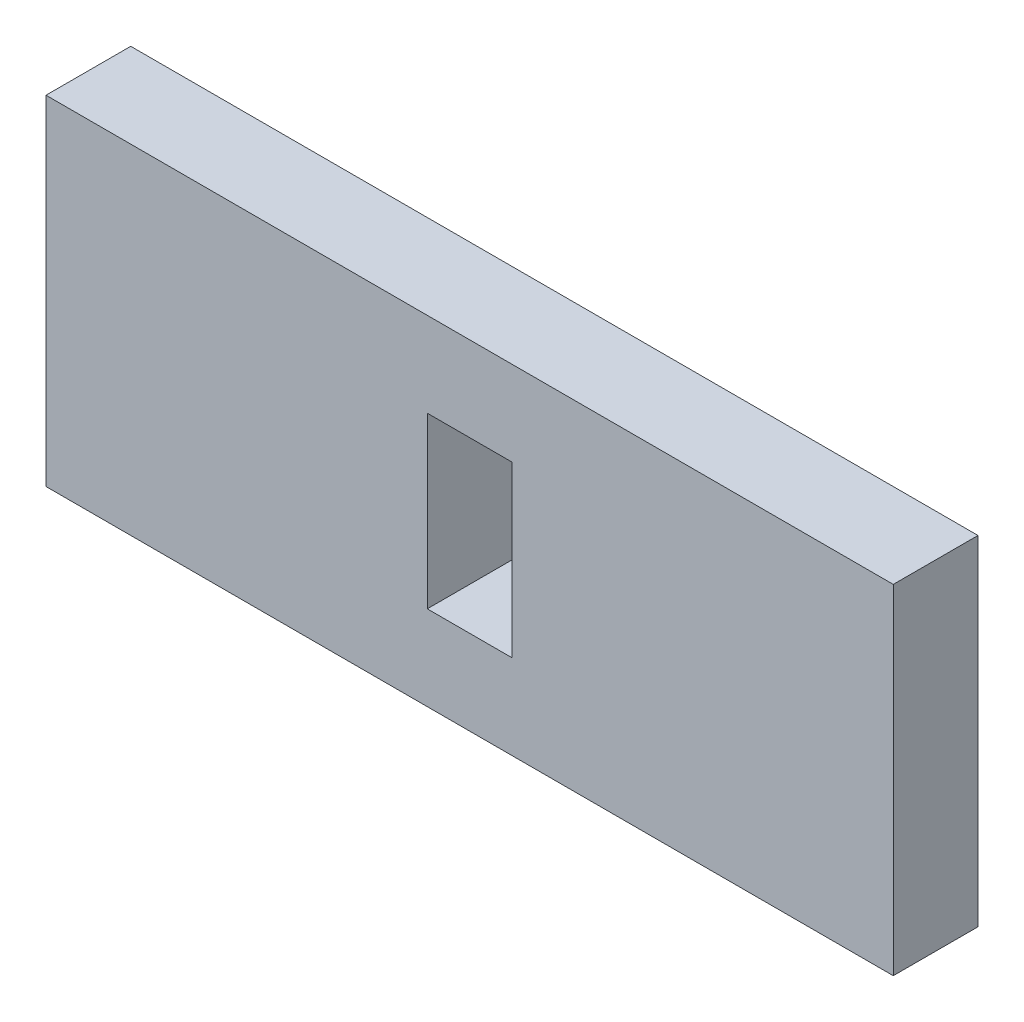
from build123d import *

# Parameters (mm, degrees)
ESQUISSE1_W        = 50
ESQUISSE1_H        = 20
ESQUISSE1_W_2      = 5
ESQUISSE1_H_2      = 10
BOSS_EXTRU_1_DEPTH = 5


with BuildPart() as part:
    # Esquisse1 → Boss.-Extru.1 (new body)
    with BuildSketch(Plane.XY):
        with Locations((-25, -10)):
            Rectangle(ESQUISSE1_W, ESQUISSE1_H)
        with Locations((-25, -10)):
            Rectangle(ESQUISSE1_W_2, ESQUISSE1_H_2, mode=Mode.SUBTRACT)
    extrude(amount=BOSS_EXTRU_1_DEPTH)


solid = part.part
